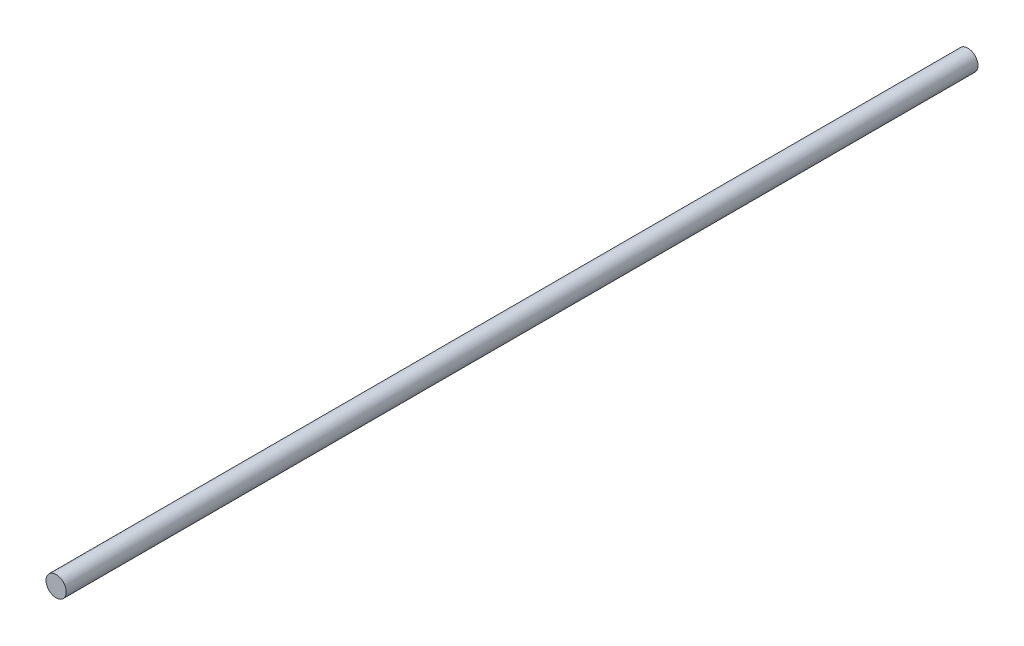
from build123d import *

# Parameters (mm, degrees)
SKETCH_1_R      = 0.5
EXTRUDE_1_DEPTH = 45


with BuildPart() as part:
    # 草图1 → 凸台-拉伸1 (new body)
    with BuildSketch(Plane.XY):
        Circle(SKETCH_1_R)
    extrude(amount=EXTRUDE_1_DEPTH)


solid = part.part
